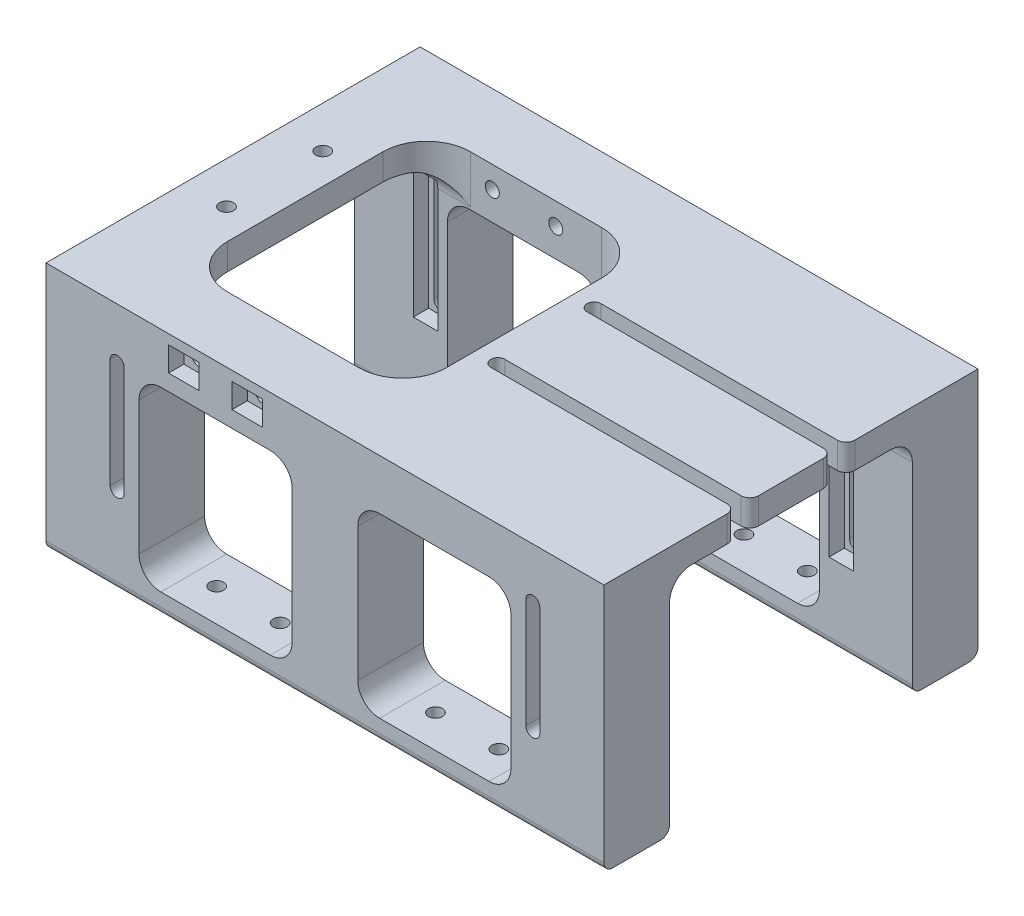
from build123d import *

# Parameters (mm, degrees)
SKETCH1_R               = 1.6
BOSS_EXTRUDE1_DEPTH     = 60
CUT_EXTRUDE1_DEPTH      = 165.822631941
SKETCH4_R               = 1.6
CUT_EXTRUDE2_DEPTH      = 165.822632055
CUT_EXTRUDE3_DEPTH      = 31.25
CUT_EXTRUDE3_DEPTH_BACK = 31.25
SKETCH5_W               = 5.6
SKETCH5_H               = 30
SKETCH8_R               = 1.6
CUT_EXTRUDE6_DEPTH      = 5
FILLET1_R               = 2
FILLET2_R               = 2
FILLET3_R               = 2
FILLET4_R               = 2
SKETCH9_W               = 7
SKETCH9_H               = 5.6
CUT_EXTRUDE7_DEPTH      = 3.5
SKETCH10_W              = 7
SKETCH10_H              = 5.6
CUT_EXTRUDE8_DEPTH      = 3.5


with BuildPart() as part:
    # Sketch1 → Boss-Extrude1 (new body)
    with BuildSketch(Plane(origin=(0, 0, 0), x_dir=(1, 0, 0), z_dir=(0, 1, 0))):
        with BuildLine():
            Line((0, 57.75), (0, 85.5))
            Line((0, 85.5), (127.5, 85.5))
            Line((127.5, 85.5), (127.5, 57.35))
            ThreePointArc((127.5, 57.35), (126.914213562, 55.935786438), (125.5, 55.35))
            Line((125.5, 55.35), (71.5, 55.35))
            ThreePointArc((71.5, 55.35), (69.9, 53.75), (71.5, 52.15))
            Line((71.5, 52.15), (125.5, 52.15))
            ThreePointArc((125.5, 52.15), (126.914213562, 51.564213562), (127.5, 50.15))
            Line((127.5, 50.15), (127.5, 35.35))
            ThreePointArc((127.5, 35.35), (126.914213562, 33.935786438), (125.5, 33.35))
            Line((125.5, 33.35), (71.5, 33.35))
            ThreePointArc((71.5, 33.35), (69.9, 31.75), (71.5, 30.15))
            Line((71.5, 30.15), (125.5, 30.15))
            ThreePointArc((125.5, 30.15), (126.914213562, 29.564213562), (127.5, 28.15))
            Line((127.5, 28.15), (127.5, 0))
            Line((127.5, 0), (0, 0))
            Line((0, 0), (0, 27.75))
            Line((0, 27.75), (0, 57.75))
        make_face()
        with Locations(Location((9.5, 53.75, 0), (0, 0, 270))):
            Circle(SKETCH1_R, mode=Mode.SUBTRACT)
        with Locations(Location((9.5, 31.75, 0), (0, 0, 270))):
            Circle(SKETCH1_R, mode=Mode.SUBTRACT)
        with BuildLine():
            Line((26.5, 15), (56.5, 15))
            ThreePointArc((56.5, 15), (63.571067812, 17.928932188), (66.5, 25))
            Line((66.5, 25), (66.5, 60.5))
            ThreePointArc((66.5, 60.5), (63.571067812, 67.571067812), (56.5, 70.5))
            Line((56.5, 70.5), (26.5, 70.5))
            ThreePointArc((26.5, 70.5), (19.428932188, 67.571067812), (16.5, 60.5))
            Line((16.5, 60.5), (16.5, 25))
            ThreePointArc((16.5, 25), (19.428932188, 17.928932188), (26.5, 15))
        make_face(mode=Mode.SUBTRACT)
    extrude(amount=BOSS_EXTRUDE1_DEPTH)

    # Sketch2 → Cut-Extrude1 (cut, through all)
    with BuildSketch(Plane.ZY):
        with BuildLine():
            Line((-70.5, 8), (-70.5, 3))
            Line((-70.5, 3), (-65.5, 3))
            Line((-65.5, 3), (-20, 3))
            Line((-20, 3), (-15, 3))
            Line((-15, 3), (-15, 8))
            Line((-15, 8), (-15, 49))
            ThreePointArc((-15, 49), (-16.464466094, 52.535533906), (-20, 54))
            Line((-20, 54), (-65.5, 54))
            ThreePointArc((-65.5, 54), (-69.035533906, 52.535533906), (-70.5, 49))
            Line((-70.5, 49), (-70.5, 8))
        make_face()
    extrude(amount=-CUT_EXTRUDE1_DEPTH, mode=Mode.SUBTRACT)

    # Sketch4 → Cut-Extrude2 (cut, through all)
    with BuildSketch(Plane(origin=(0, 0, -85.5), x_dir=(-1, 0, 0), z_dir=(0, 0, -1))):
        with Locations((-46, 55)):
            Circle(SKETCH4_R)
        with Locations((-31.5, 55)):
            Circle(SKETCH4_R)
        with BuildLine():
            Line((-56.25, 43.5), (-56.25, 13))
            ThreePointArc((-56.25, 13), (-54.785533906, 9.464466094), (-51.25, 8))
            Line((-51.25, 8), (-26.25, 8))
            ThreePointArc((-26.25, 8), (-22.714466094, 9.464466094), (-21.25, 13))
            Line((-21.25, 13), (-21.25, 43.5))
            ThreePointArc((-21.25, 43.5), (-22.714466094, 47.035533906), (-26.25, 48.5))
            Line((-26.25, 48.5), (-51.25, 48.5))
            ThreePointArc((-51.25, 48.5), (-54.785533906, 47.035533906), (-56.25, 43.5))
        make_face()
        with BuildLine():
            Line((-101.25, 48.5), (-76.25, 48.5))
            ThreePointArc((-76.25, 48.5), (-72.714466094, 47.035533906), (-71.25, 43.5))
            Line((-71.25, 43.5), (-71.25, 13))
            ThreePointArc((-71.25, 13), (-72.714466094, 9.464466094), (-76.25, 8))
            Line((-76.25, 8), (-101.25, 8))
            ThreePointArc((-101.25, 8), (-104.785533906, 9.464466094), (-106.25, 13))
            Line((-106.25, 13), (-106.25, 43.5))
            ThreePointArc((-106.25, 43.5), (-104.785533906, 47.035533906), (-101.25, 48.5))
        make_face()
        with BuildLine():
            Line((-112.85, 23.25), (-112.85, 48.25))
            ThreePointArc((-112.85, 48.25), (-111.25, 49.85), (-109.65, 48.25))
            Line((-109.65, 48.25), (-109.65, 23.25))
            ThreePointArc((-109.65, 23.25), (-111.25, 21.65), (-112.85, 23.25))
        make_face()
        with BuildLine():
            Line((-17.85, 23.25), (-17.85, 48.25))
            ThreePointArc((-17.85, 48.25), (-16.25, 49.85), (-14.65, 48.25))
            Line((-14.65, 48.25), (-14.65, 23.25))
            ThreePointArc((-14.65, 23.25), (-16.25, 21.65), (-17.85, 23.25))
        make_face()
    extrude(amount=-CUT_EXTRUDE2_DEPTH, mode=Mode.SUBTRACT)

    # Sketch5 → Cut-Extrude3 (cut, two sides: drawn at the far end of the back side and taken through both)
    with BuildSketch(Plane.XY.offset(-42.75).offset(-CUT_EXTRUDE3_DEPTH_BACK)):
        with Locations((16.25, 35.75)):
            Rectangle(SKETCH5_W, SKETCH5_H)
        with Locations((111.25, 35.75)):
            Rectangle(SKETCH5_W, SKETCH5_H)
    extrude(amount=CUT_EXTRUDE3_DEPTH + CUT_EXTRUDE3_DEPTH_BACK, mode=Mode.SUBTRACT)

    # SurfaceCut1
    split(bisect_by=Plane(origin=(0, 3, 0), x_dir=(1, 0, 0), z_dir=(0, 1, 0)), keep=Keep.TOP)

    # Sketch8 → Cut-Extrude6 (cut)
    with BuildSketch(Plane.XZ.offset(-3)):
        with Locations(Location((31.5, -7.5, 0), (0, 0, 270))):
            Circle(SKETCH8_R)
        with Locations(Location((46, -7.5, 0), (0, 0, 270))):
            Circle(SKETCH8_R)
        with Locations(Location((31.5, -78, 0), (0, 0, 270))):
            Circle(SKETCH8_R)
        with Locations(Location((46, -78, 0), (0, 0, 270))):
            Circle(SKETCH8_R)
        with Locations(Location((81.5, -7.5, 0), (0, 0, 270))):
            Circle(SKETCH8_R)
        with Locations(Location((96, -7.5, 0), (0, 0, 270))):
            Circle(SKETCH8_R)
        with Locations(Location((81.5, -78, 0), (0, 0, 270))):
            Circle(SKETCH8_R)
        with Locations(Location((96, -78, 0), (0, 0, 270))):
            Circle(SKETCH8_R)
    extrude(amount=-CUT_EXTRUDE6_DEPTH, mode=Mode.SUBTRACT)

    # Fillet1
    fillet1_edges = [part.edges().sort_by_distance(p)[0] for p in [
        (63.75, 3, 0),
    ]]
    fillet(fillet1_edges, radius=FILLET1_R)

    # Fillet2
    fillet2_edges = [part.edges().sort_by_distance(p)[0] for p in [
        (63.75, 3, -15),
    ]]
    fillet(fillet2_edges, radius=FILLET2_R)

    # Fillet3
    fillet3_edges = [part.edges().sort_by_distance(p)[0] for p in [
        (63.75, 3, -70.5),
    ]]
    fillet(fillet3_edges, radius=FILLET3_R)

    # Fillet4
    fillet4_edges = [part.edges().sort_by_distance(p)[0] for p in [
        (63.75, 3, -85.5),
    ]]
    fillet(fillet4_edges, radius=FILLET4_R)

    # Sketch9 → Cut-Extrude7 (cut)
    with BuildSketch(Plane(origin=(0, 0, -85.5), x_dir=(-1, 0, 0), z_dir=(0, 0, -1))):
        with Locations((-46, 55)):
            Rectangle(SKETCH9_W, SKETCH9_H)
        with Locations((-31.5, 55)):
            Rectangle(SKETCH9_W, SKETCH9_H)
    extrude(amount=-CUT_EXTRUDE7_DEPTH, mode=Mode.SUBTRACT)

    # Sketch10 → Cut-Extrude8 (cut)
    with BuildSketch(Plane.XY):
        with Locations((31.5, 55)):
            Rectangle(SKETCH10_W, SKETCH10_H)
        with Locations((46, 55)):
            Rectangle(SKETCH10_W, SKETCH10_H)
    extrude(amount=-CUT_EXTRUDE8_DEPTH, mode=Mode.SUBTRACT)


solid = part.part
